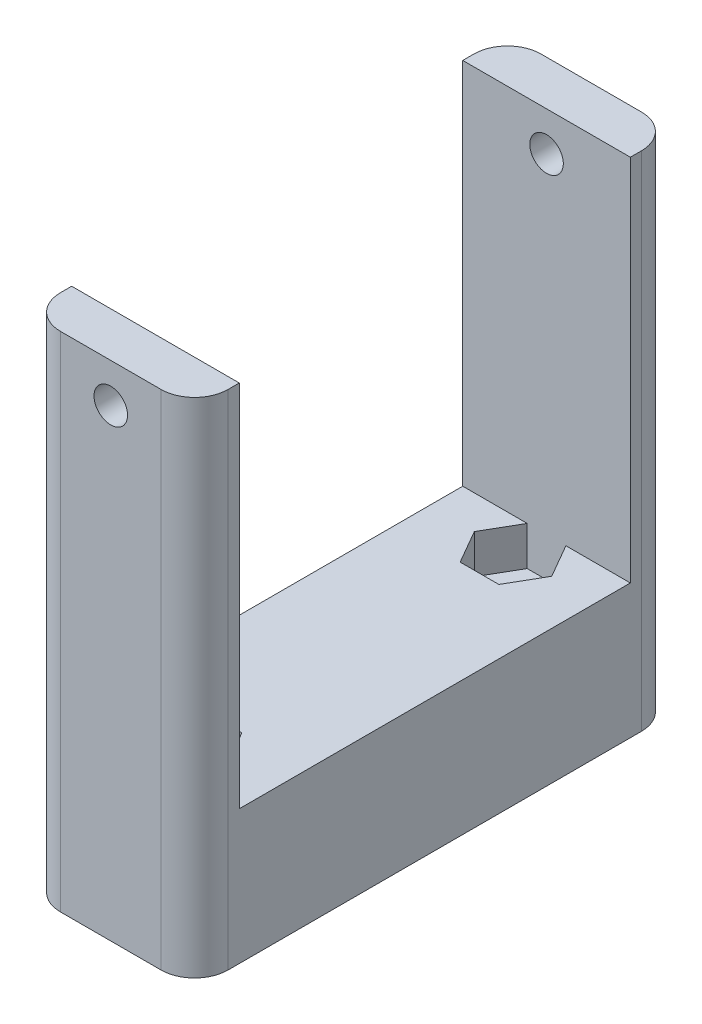
from build123d import *

# Parameters (mm, degrees)
CROQUIS1_W                 = 15
CROQUIS1_H                 = 43
SALIENTE_EXTRUIR1_DEPTH    = 12
CROQUIS2_W                 = 15
CROQUIS2_H                 = 4
SALIENTE_EXTRUIR2_DEPTH    = 33
CROQUIS3_R                 = 1.5
CORTAR_EXTRUIR1_DEPTH      = 13
CORTAR_EXTRUIR2_DEPTH      = 3.5
REDONDEO1_R                = 3
CORTAR_EXTRUIR3_DEPTH      = 63.691705991
CORTAR_EXTRUIR3_DEPTH_BACK = 63.691705991
CROQUIS5_R                 = 1.5


with BuildPart() as part:
    # Croquis1 → Saliente-Extruir1 (new body)
    with BuildSketch(Plane(origin=(0, 0, 0), x_dir=(1, 0, 0), z_dir=(0, 1, 0))):
        Rectangle(CROQUIS1_W, CROQUIS1_H)
    extrude(amount=SALIENTE_EXTRUIR1_DEPTH)

    # Croquis2 → Saliente-Extruir2 (add)
    with BuildSketch(Plane(origin=(0, 12, 0), x_dir=(1, 0, 0), z_dir=(0, 1, 0))):
        with Locations((0, 19.5)):
            Rectangle(CROQUIS2_W, CROQUIS2_H)
        with Locations((0, -19.5)):
            Rectangle(CROQUIS2_W, CROQUIS2_H)
    extrude(amount=SALIENTE_EXTRUIR2_DEPTH)

    # Croquis3 → Cortar-Extruir1 (cut)
    with BuildSketch(Plane.XZ):
        with Locations(Location((0, 14.5, 0), (0, 0, 270))):
            Circle(CROQUIS3_R)
        with Locations(Location((0, -14.5, 0), (0, 0, 270))):
            Circle(CROQUIS3_R)
    extrude(amount=-CORTAR_EXTRUIR1_DEPTH, mode=Mode.SUBTRACT)

    # Croquis4 → Cortar-Extruir2 (cut)
    with BuildSketch(Plane(origin=(0, 12, 0), x_dir=(1, 0, 0), z_dir=(0, 1, 0))):
        Polygon((3.464101615, 14.5), (1.732050808, 17.5), (-1.732050808, 17.5), (-3.464101615, 14.5), (-1.732050808, 11.5), (1.732050808, 11.5), align=None)
        Polygon((3.464101615, -14.5), (1.732050808, -11.5), (-1.732050808, -11.5), (-3.464101615, -14.5), (-1.732050808, -17.5), (1.732050808, -17.5), align=None)
    extrude(amount=-CORTAR_EXTRUIR2_DEPTH, mode=Mode.SUBTRACT)

    # Redondeo1
    redondeo1_edges = [part.edges().sort_by_distance(p)[0] for p in [
        (-7.5, 22.5, -21.5),
        (7.5, 22.5, -21.5),
        (7.5, 22.5, 21.5),
        (-7.5, 22.5, 21.5),
    ]]
    fillet(redondeo1_edges, radius=REDONDEO1_R)

    # Croquis5 → Cortar-Extruir3 (cut, two sides: drawn at the far end of the back side and taken through both)
    with BuildSketch(Plane(origin=(0, 0, -21.5), x_dir=(-1, 0, 0), z_dir=(0, 0, -1)).offset(-CORTAR_EXTRUIR3_DEPTH_BACK)):
        with Locations((0, 41.5)):
            Circle(CROQUIS5_R)
    extrude(amount=CORTAR_EXTRUIR3_DEPTH + CORTAR_EXTRUIR3_DEPTH_BACK, mode=Mode.SUBTRACT)


solid = part.part
